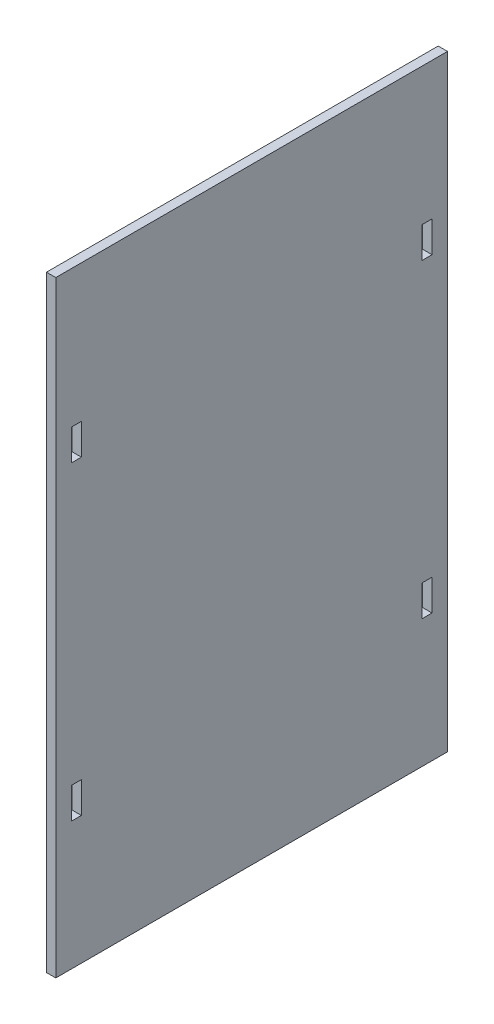
from build123d import *

# Parameters (mm, degrees)
SKETCH1_W           = 252.5
SKETCH1_H           = 391
SKETCH1_W_2         = 6.5
SKETCH1_H_2         = 20
BOSS_EXTRUDE1_DEPTH = 6


with BuildPart() as part:
    # Sketch1 → Boss-Extrude1 (new body)
    with BuildSketch(Plane(origin=(0, 0, 0), x_dir=(0, 0, -1), z_dir=(1, 0, 0))):
        with Locations((126.25, 195.5)):
            Rectangle(SKETCH1_W, SKETCH1_H)
        with Locations((13.25, 292.5)):
            Rectangle(SKETCH1_W_2, SKETCH1_H_2, mode=Mode.SUBTRACT)
        with Locations((239.25, 292.5)):
            Rectangle(SKETCH1_W_2, SKETCH1_H_2, mode=Mode.SUBTRACT)
        with Locations((239.25, 92.5)):
            Rectangle(SKETCH1_W_2, SKETCH1_H_2, mode=Mode.SUBTRACT)
        with Locations((13.25, 92.5)):
            Rectangle(SKETCH1_W_2, SKETCH1_H_2, mode=Mode.SUBTRACT)
    extrude(amount=BOSS_EXTRUDE1_DEPTH)


solid = part.part
